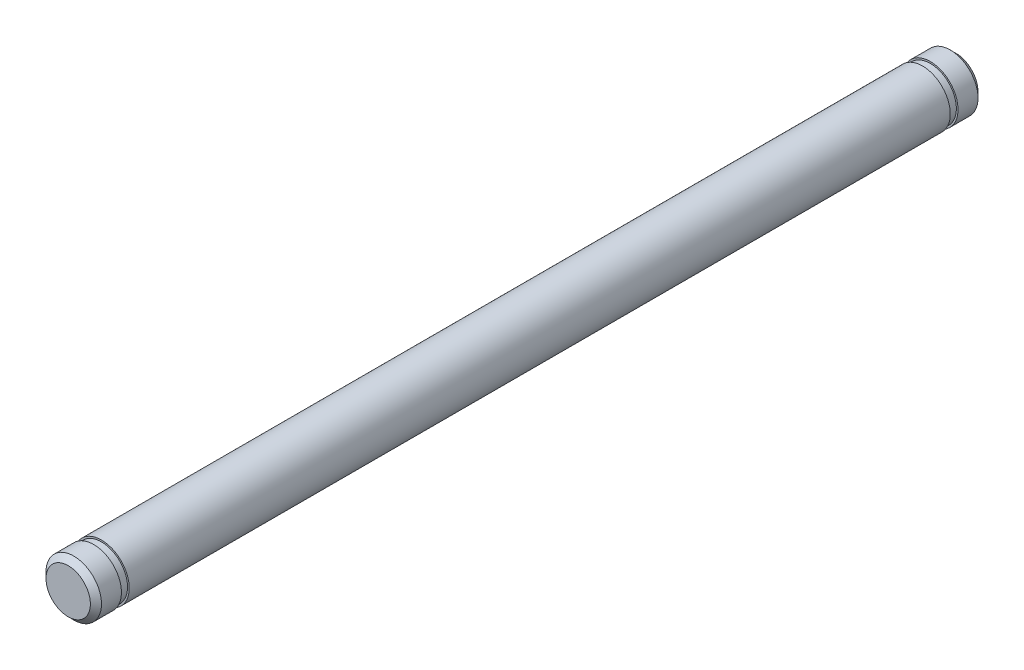
from build123d import *

# Parameters (mm, degrees)
SKETCH_1_R          = 2.5
EXTRUDE_1_DEPTH     = 80
CHAMFER_1_SIZE      = 0.5
CUT_EXTRUDE_START   = -2.3
SKETCH_2_R          = 2.5
SKETCH_2_R_2        = 2.35
CUT_EXTRUDE_1_DEPTH = 0.7


with BuildPart() as part:
    # 草图1 → 凸台-拉伸1 (new body)
    with BuildSketch(Plane.XY):
        Circle(SKETCH_1_R)
    extrude(amount=EXTRUDE_1_DEPTH)

    # 倒角1
    chamfer_1_edges = [part.edges().sort_by_distance(p)[0] for p in [
        (-2.5, 0, 0),
        (-2.5, 0, 80),
    ]]
    chamfer(chamfer_1_edges, length=CHAMFER_1_SIZE)

    # 草图2 → 切除-拉伸1 (cut)
    with BuildSketch(Plane(origin=(0, 0, 0), x_dir=(-1, 0, 0), z_dir=(0, 0, -1)).offset(CUT_EXTRUDE_START)):
        Circle(SKETCH_2_R)
        Circle(SKETCH_2_R_2, mode=Mode.SUBTRACT)
    cut_extrude_1 = extrude(amount=-CUT_EXTRUDE_1_DEPTH, mode=Mode.SUBTRACT)

    # 镜向1: 切除-拉伸1 across plane
    add(cut_extrude_1.mirror(Plane.XY.offset(40)), mode=Mode.SUBTRACT)


solid = part.part
